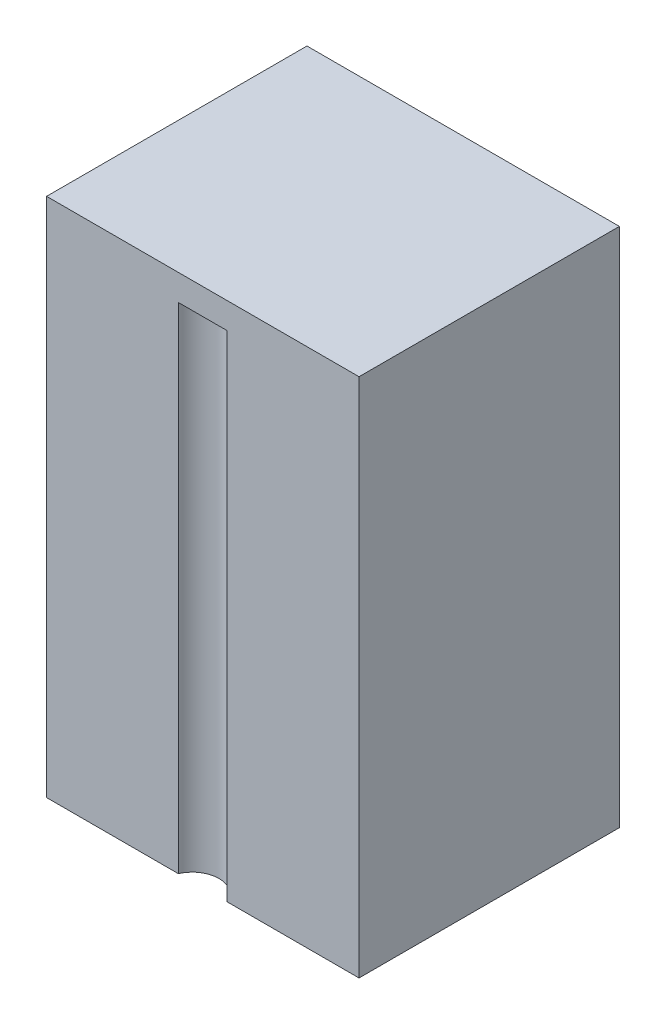
from build123d import *

# Parameters (mm, degrees)
SKETCH1_W           = 30
SKETCH1_H           = 25
BOSS_EXTRUDE1_DEPTH = 50
CUT_EXTRUDE2_START  = 2.5
SKETCH1_5_W         = 25
SKETCH1_5_H         = 20
CUT_EXTRUDE2_DEPTH  = 45
BOSS_EXTRUDE3_START = 25
SKETCH1_6_W         = 25
SKETCH1_6_H         = 20
BOSS_EXTRUDE3_DEPTH = 1
SKETCH2_R           = 2.55
CUT_EXTRUDE3_DEPTH  = 47.5
SKETCH4_W           = 25
SKETCH4_H           = 5
CUT_EXTRUDE4_DEPTH  = 1


with BuildPart() as part:
    # Sketch1 → Boss-Extrude1 (new body)
    with BuildSketch(Plane(origin=(0, 0, 0), x_dir=(1, 0, 0), z_dir=(0, 1, 0))):
        Rectangle(SKETCH1_W, SKETCH1_H)
    extrude(amount=BOSS_EXTRUDE1_DEPTH)

    # Sketch1<5> → Cut-Extrude2 (cut)
    with BuildSketch(Plane(origin=(0, 0, 0), x_dir=(1, 0, 0), z_dir=(0, 1, 0)).offset(CUT_EXTRUDE2_START)):
        Rectangle(SKETCH1_5_W, SKETCH1_5_H)
    extrude(amount=CUT_EXTRUDE2_DEPTH, mode=Mode.SUBTRACT)

    # Sketch1<6> → Boss-Extrude3 (add)
    with BuildSketch(Plane(origin=(0, 0, 0), x_dir=(1, 0, 0), z_dir=(0, 1, 0)).offset(BOSS_EXTRUDE3_START)):
        Rectangle(SKETCH1_6_W, SKETCH1_6_H)
    extrude(amount=BOSS_EXTRUDE3_DEPTH)

    # Sketch2 → Cut-Extrude3 (cut)
    with BuildSketch(Plane(origin=(0, 47.5, 0), x_dir=(-1, 0, 0), z_dir=(0, -1, 0))):
        with Locations((0, -13.5)):
            Circle(SKETCH2_R)
    extrude(amount=CUT_EXTRUDE3_DEPTH, mode=Mode.SUBTRACT)

    # Sketch4 → Cut-Extrude4 (cut)
    with BuildSketch(Plane(origin=(0, 26, 0), x_dir=(1, 0, 0), z_dir=(0, 1, 0))):
        with Locations((0, -7.5)):
            Rectangle(SKETCH4_W, SKETCH4_H)
    extrude(amount=-CUT_EXTRUDE4_DEPTH, mode=Mode.SUBTRACT)


solid = part.part
